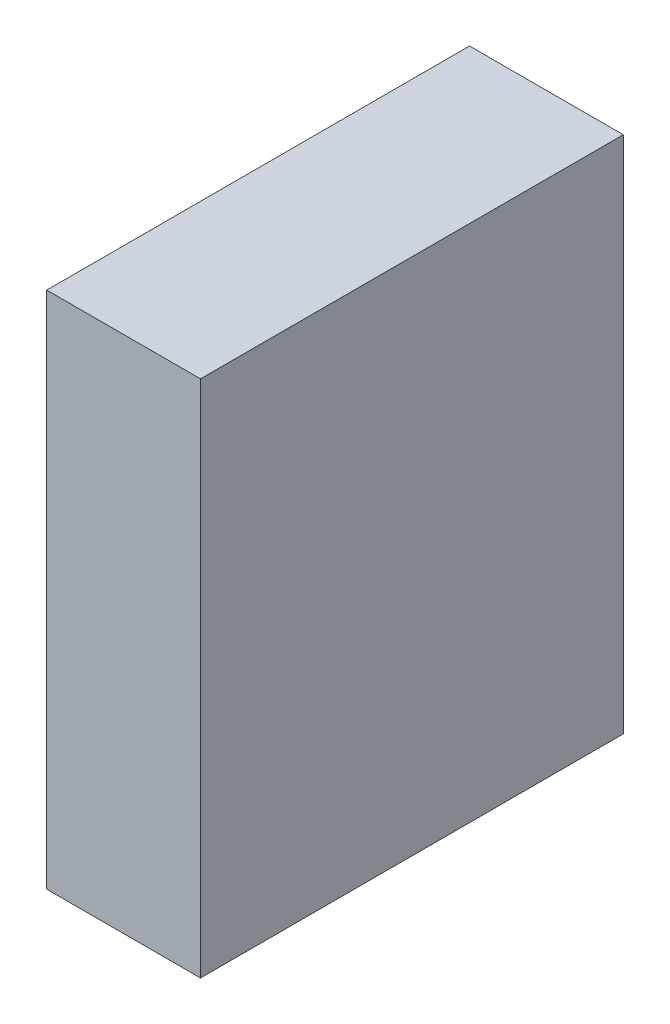
from build123d import *

# Parameters (mm, degrees)
SKETCH1_W           = 13.333333334
SKETCH1_H           = 36.66666667
BOSS_EXTRUDE1_DEPTH = 45


with BuildPart() as part:
    # Sketch1 → Boss-Extrude1 (new body)
    with BuildSketch(Plane(origin=(0, 0, 0), x_dir=(1, 0, 0), z_dir=(0, 1, 0))):
        Rectangle(SKETCH1_W, SKETCH1_H)
    extrude(amount=BOSS_EXTRUDE1_DEPTH)


solid = part.part
